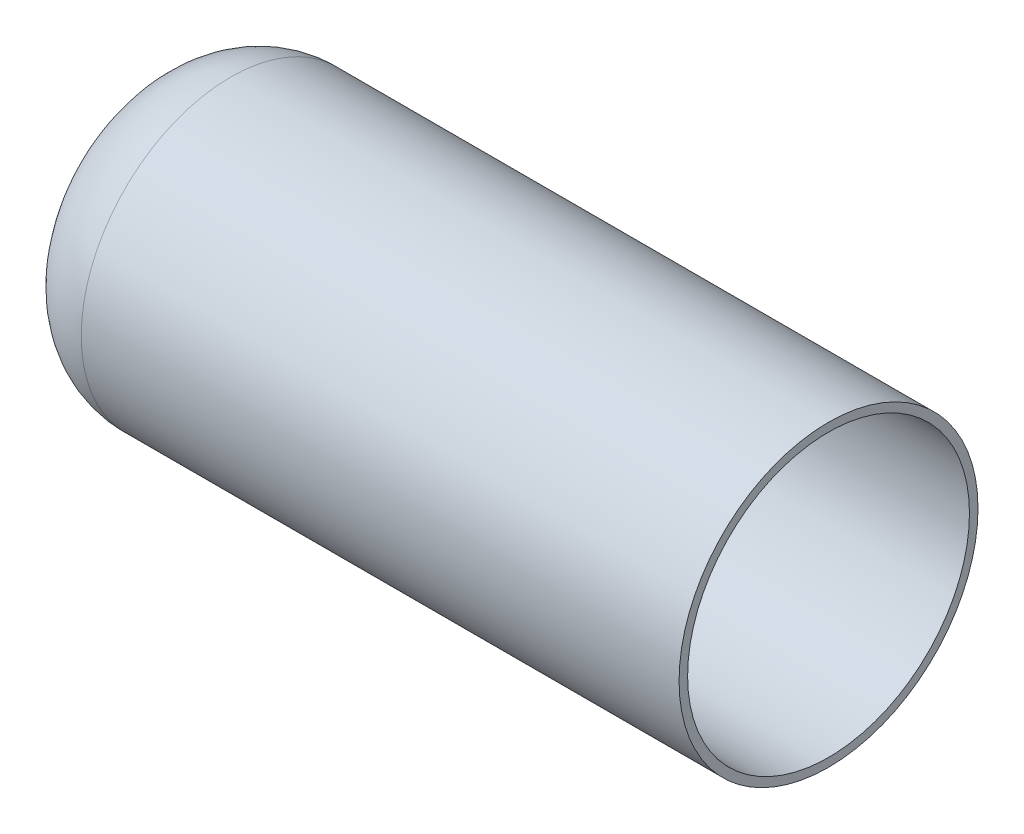
from build123d import *

# Parameters (mm, degrees)
THICKEN1_T2         = 2
SKETCH2_R           = 35
SKETCH2_R_2         = 33
BOSS_EXTRUDE1_DEPTH = 140


with BuildPart() as body_1:
    # Surface-Revolve1: a surface, the sketch's curves turned about an axis
    with BuildLine(Plane(origin=(0, 0, 0), x_dir=(1, 0, 0), z_dir=(0, 1, 0)), mode=Mode.PRIVATE) as surface_revolve1_1_path:
        Line((0, 0), (0, 15))
        ThreePointArc((0, 15), (5.857864376, 29.142135624), (20, 35))
    surface_revolve1_1 = Shell.revolve(surface_revolve1_1_path.wire(), 360, Axis((0, 0, 0), (1, 0, 0)))
    add(Solid.thicken(surface_revolve1_1, -THICKEN1_T2))

    # Sketch2 → Boss-Extrude1 (add)
    with BuildSketch(Plane(origin=(20, 0, 0), x_dir=(0, 0, -1), z_dir=(1, 0, 0))):
        Circle(SKETCH2_R)
        Circle(SKETCH2_R_2, mode=Mode.SUBTRACT)
    extrude(amount=BOSS_EXTRUDE1_DEPTH)


solid = body_1.part
